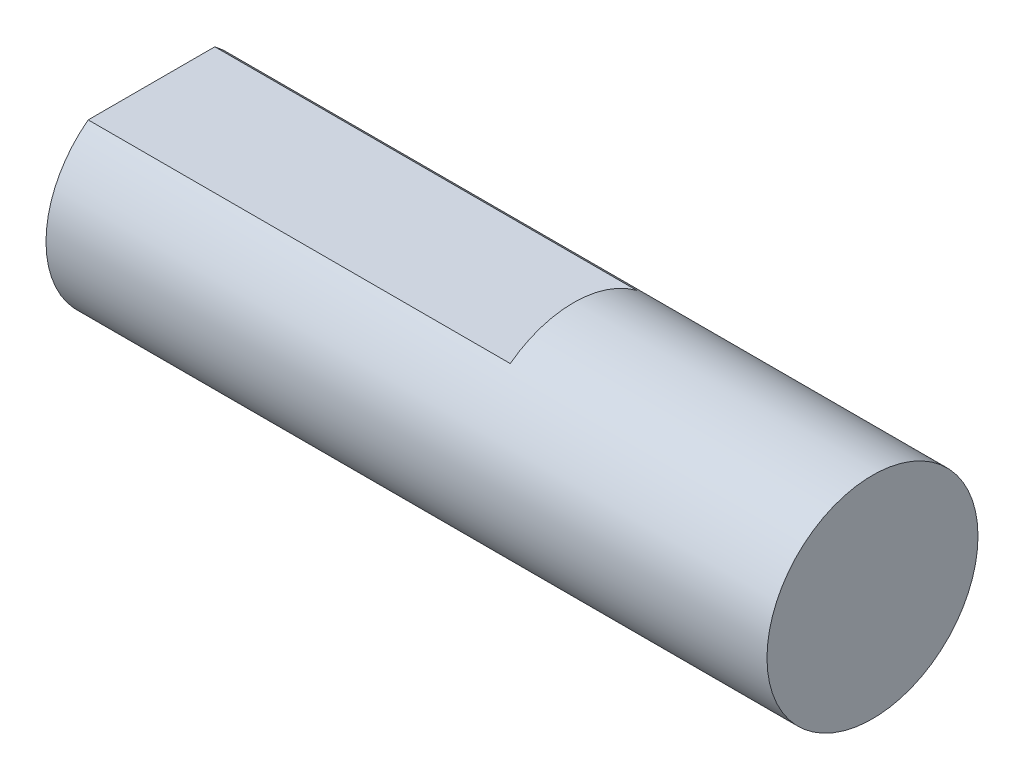
from build123d import *

# Parameters (mm, degrees)
SKETCH1_W                      = 20.5
SKETCH1_H                      = 3
CUT_EXTRUDE1_REACH             = 22.934
SKETCH2_W                      = 12
SKETCH2_H                      = 2
CUT_EXTRUDE1_DIRECTION_2_REACH = 22.934


with BuildPart() as part:
    # Sketch1 → Revolve1 (revolve)
    with BuildSketch(Plane.XY, mode=Mode.PRIVATE) as revolve1_sk:
        with Locations((-10.25, 1.5)):
            Rectangle(SKETCH1_W, SKETCH1_H)
    revolve(revolve1_sk.sketch.rotate(Axis((-20.5, 0, 0), (1, 0, 0)), 90), axis=Axis((-20.5, 0, 0), (1, 0, 0)))

    # Sketch2 → Cut-Extrude1 (cut, up to next)
    with BuildSketch(Plane.XY, mode=Mode.PRIVATE) as cut_extrude1_sk1:
        with Locations((-14.5, 3.4)):
            Rectangle(SKETCH2_W, SKETCH2_H)
    cut_extrude1_tool1 = extrude(cut_extrude1_sk1.sketch, amount=-CUT_EXTRUDE1_REACH, mode=Mode.PRIVATE) & part.part
    add(cut_extrude1_tool1.solids().sort_by_distance((-14.5, 3.4, 0))[0], mode=Mode.SUBTRACT)

    # Sketch2 → Cut-Extrude1 direction 2 (cut, up to next)
    with BuildSketch(Plane.XY, mode=Mode.PRIVATE) as cut_extrude1_direction_2_sk1:
        with Locations((-14.5, 3.4)):
            Rectangle(SKETCH2_W, SKETCH2_H)
    cut_extrude1_direction_2_tool1 = extrude(cut_extrude1_direction_2_sk1.sketch, amount=CUT_EXTRUDE1_DIRECTION_2_REACH, mode=Mode.PRIVATE) & part.part
    add(cut_extrude1_direction_2_tool1.solids().sort_by_distance((-14.5, 3.4, 0))[0], mode=Mode.SUBTRACT)


solid = part.part
